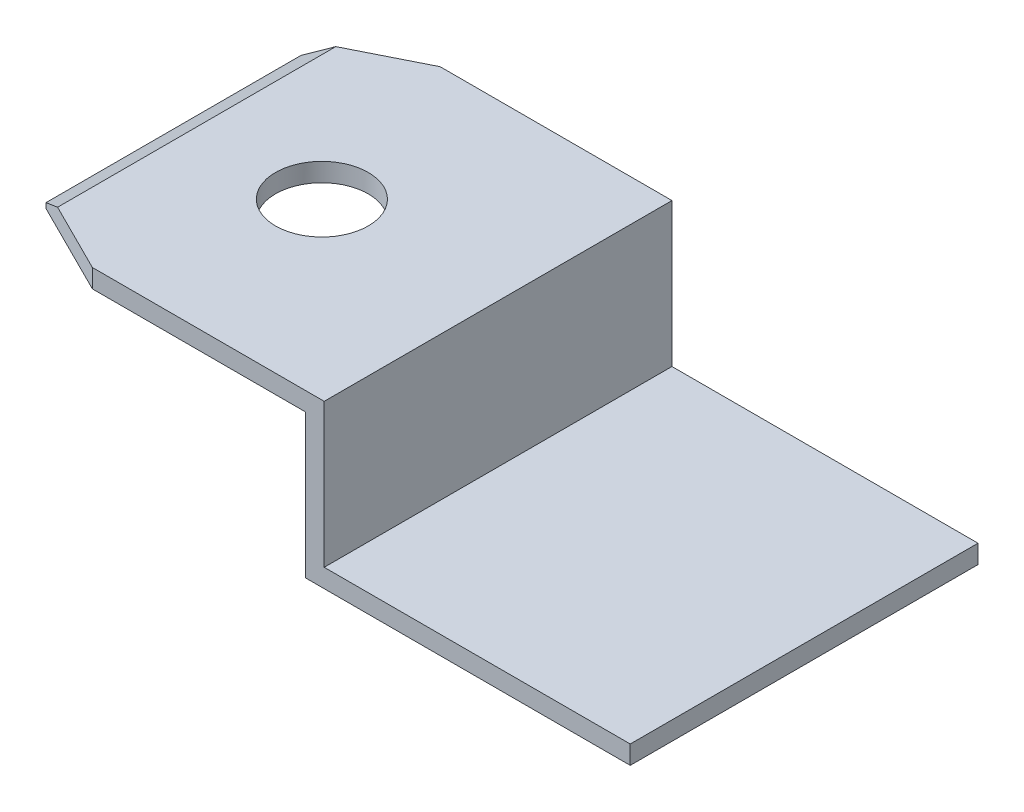
from build123d import *

# Parameters (mm, degrees)
BOSS_EXTRUDE1_DEPTH = 75
SKETCH2_R           = 10
CUT_EXTRUDE1_DEPTH  = 160.204271299
CHAMFER1_SIZE       = 10
CHAMFER1_SIZE2      = 20
CHAMFER2_SIZE       = 20
CHAMFER2_SIZE2      = 10
CHAMFER3_SIZE       = 5
CHAMFER3_SIZE2      = 2.886751346


with BuildPart() as part:
    # Sketch1 → Boss-Extrude1 (new body)
    with BuildSketch(Plane.XY):
        Polygon((0, 0), (70, 0), (70, -31), (136, -31), (136, -35), (66, -35), (66, -4), (0, -4), align=None)
    extrude(amount=BOSS_EXTRUDE1_DEPTH)

    # Sketch2 → Cut-Extrude1 (cut, through all)
    with BuildSketch(Plane(origin=(0, 0, 0), x_dir=(1, 0, 0), z_dir=(0, 1, 0))):
        with Locations(Location((32, -37.5, 0), (0, 0, 270))):
            Circle(SKETCH2_R)
    extrude(amount=-CUT_EXTRUDE1_DEPTH, mode=Mode.SUBTRACT)

    # Chamfer1
    chamfer1_edges = [part.edges().sort_by_distance(p)[0] for p in [
        (0, -2, 75),
    ]]
    chamfer1_side = [part.faces().sort_by_distance(p)[0] for p in [
        (0, -2, 37.5),
    ]]
    chamfer(chamfer1_edges, length=CHAMFER1_SIZE, length2=CHAMFER1_SIZE2, reference=chamfer1_side[0])

    # Chamfer2
    chamfer2_edges = [part.edges().sort_by_distance(p)[0] for p in [
        (0, -2, 0),
    ]]
    chamfer2_side = [part.faces().sort_by_distance(p)[0] for p in [
        (68, -17.5, 0),
    ]]
    chamfer(chamfer2_edges, length=CHAMFER2_SIZE, length2=CHAMFER2_SIZE2, reference=chamfer2_side[0])

    # Chamfer3
    chamfer3_edges = [part.edges().sort_by_distance(p)[0] for p in [
        (0, 0, 37.5),
    ]]
    chamfer3_side = [part.faces().sort_by_distance(p)[0] for p in [
        (1.025914226, 0, 37.5),
    ]]
    chamfer(chamfer3_edges, length=CHAMFER3_SIZE, length2=CHAMFER3_SIZE2, reference=chamfer3_side[0])


solid = part.part
